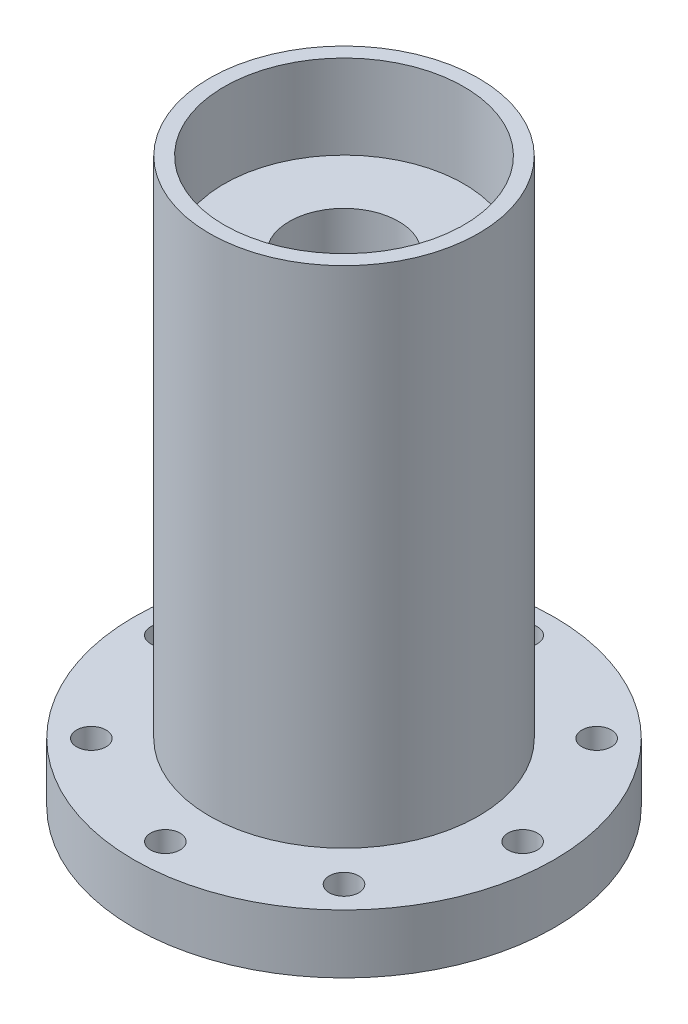
from build123d import *

# Parameters (mm, degrees)
SKETCH3_R          = 1.75
CUT_EXTRUDE1_DEPTH = 10


with BuildPart() as part:
    # Sketch1 → Revolve1 (revolve)
    with BuildSketch(Plane(origin=(0, 0, 0), x_dir=(0, 0, -1), z_dir=(1, 0, 0))):
        Polygon((-16, -48.096567582), (-16, -108.096567582), (-25, -108.096567582), (-25, -115.096567582), (-14.25, -115.096567582), (-14.25, -105.096567582), (-6.5, -105.096567582), (-6.5, -58.096567582), (-14.25, -58.096567582), (-14.25, -48.096567582), align=None)
    revolve(axis=Axis((0, 150, 0), (0, -1, 0)))

    # Sketch3 → Cut-Extrude1 (cut)
    with BuildSketch(Plane.XZ.offset(115.096567582)):
        with Locations(Location((0, -21.25, 0), (0, 0, 270))):
            Circle(SKETCH3_R)
        with Locations(Location((-15.0260191, -15.0260191, 0), (0, 0, 270))):
            Circle(SKETCH3_R)
        with Locations(Location((-21.25, 0, 0), (0, 0, 270))):
            Circle(SKETCH3_R)
        with Locations(Location((-15.0260191, 15.0260191, 0), (0, 0, 270))):
            Circle(SKETCH3_R)
        with Locations(Location((0, 21.25, 0), (0, 0, 270))):
            Circle(SKETCH3_R)
        with Locations(Location((15.0260191, 15.0260191, 0), (0, 0, 270))):
            Circle(SKETCH3_R)
        with Locations(Location((21.25, 0, 0), (0, 0, 270))):
            Circle(SKETCH3_R)
        with Locations(Location((15.0260191, -15.0260191, 0), (0, 0, 270))):
            Circle(SKETCH3_R)
    extrude(amount=-CUT_EXTRUDE1_DEPTH, mode=Mode.SUBTRACT)


solid = part.part
